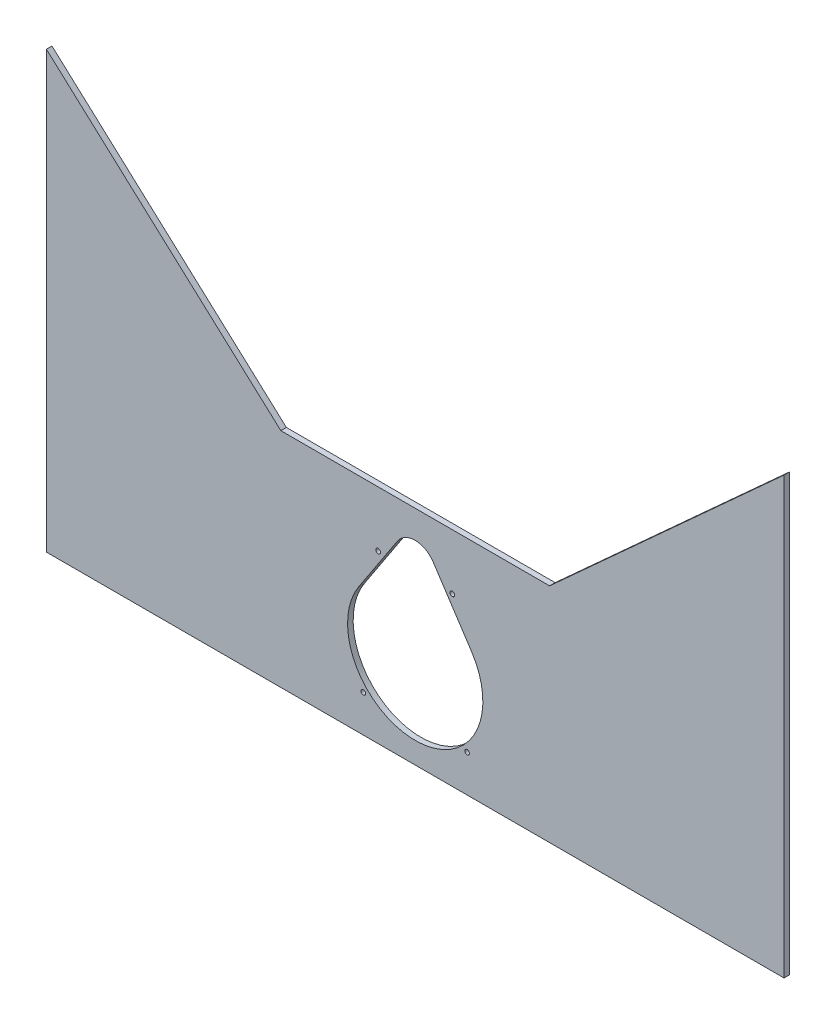
from build123d import *

# Parameters (mm, degrees)
SKETCH1_R           = 1.25
BOSS_EXTRUDE1_DEPTH = 3


with BuildPart() as part:
    # Sketch1 → Boss-Extrude1 (new body)
    with BuildSketch(Plane.XY):
        Polygon((0, 0), (398, 0), (398, 235), (271.5, 120), (126.5, 120), (0, 235), align=None)
        with Locations((171, 20)):
            Circle(SKETCH1_R, mode=Mode.SUBTRACT)
        with Locations((227, 20)):
            Circle(SKETCH1_R, mode=Mode.SUBTRACT)
        with Locations((179, 90)):
            Circle(SKETCH1_R, mode=Mode.SUBTRACT)
        with Locations((219, 90)):
            Circle(SKETCH1_R, mode=Mode.SUBTRACT)
        with BuildLine():
            Line((168.503292328, 68.054945055), (189.391448268, 99.818681319))
            ThreePointArc((189.391448268, 99.818681319), (199, 105), (208.608551732, 99.818681319))
            Line((208.608551732, 99.818681319), (229.496707672, 68.054945055))
            ThreePointArc((229.496707672, 68.054945055), (199, 11.5), (168.503292328, 68.054945055))
        make_face(mode=Mode.SUBTRACT)
    extrude(amount=BOSS_EXTRUDE1_DEPTH)


solid = part.part
